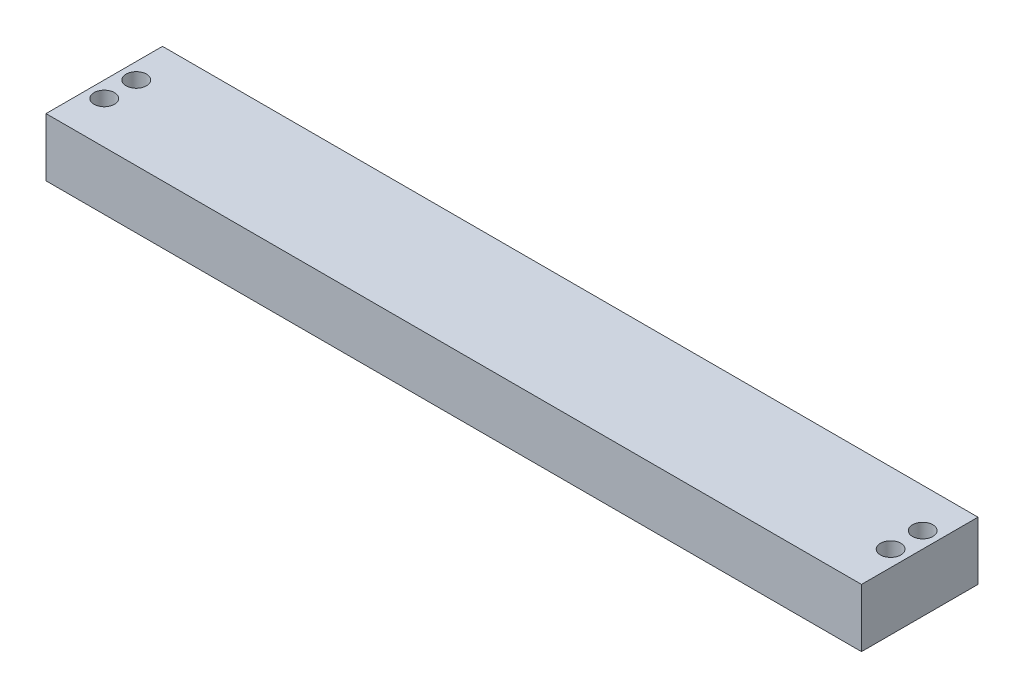
from build123d import *

# Parameters (mm, degrees)
SKETCH_1_W          = 280
SKETCH_1_H          = 20
EXTRUDE_1_DEPTH     = 40
SKETCH_2_R          = 3.5
CUT_EXTRUDE_1_DEPTH = 30


with BuildPart() as part:
    # 스케치1 → 보스-돌출1 (new body)
    with BuildSketch(Plane.XY):
        Rectangle(SKETCH_1_W, SKETCH_1_H)
    extrude(amount=EXTRUDE_1_DEPTH)

    # 스케치2 → 컷-돌출1 (cut)
    with BuildSketch(Plane.XZ.offset(10)):
        with Locations(Location((-134.5, 25.5, 0), (0, 0, 270))):
            Circle(SKETCH_2_R)
        with Locations(Location((-134.5, 14.5, 0), (0, 0, 270))):
            Circle(SKETCH_2_R)
        with Locations(Location((134.5, 24.5, 0), (0, 0, 270))):
            Circle(SKETCH_2_R)
        with Locations(Location((134.5, 13.5, 0), (0, 0, 270))):
            Circle(SKETCH_2_R)
    extrude(amount=-CUT_EXTRUDE_1_DEPTH, mode=Mode.SUBTRACT)


solid = part.part
